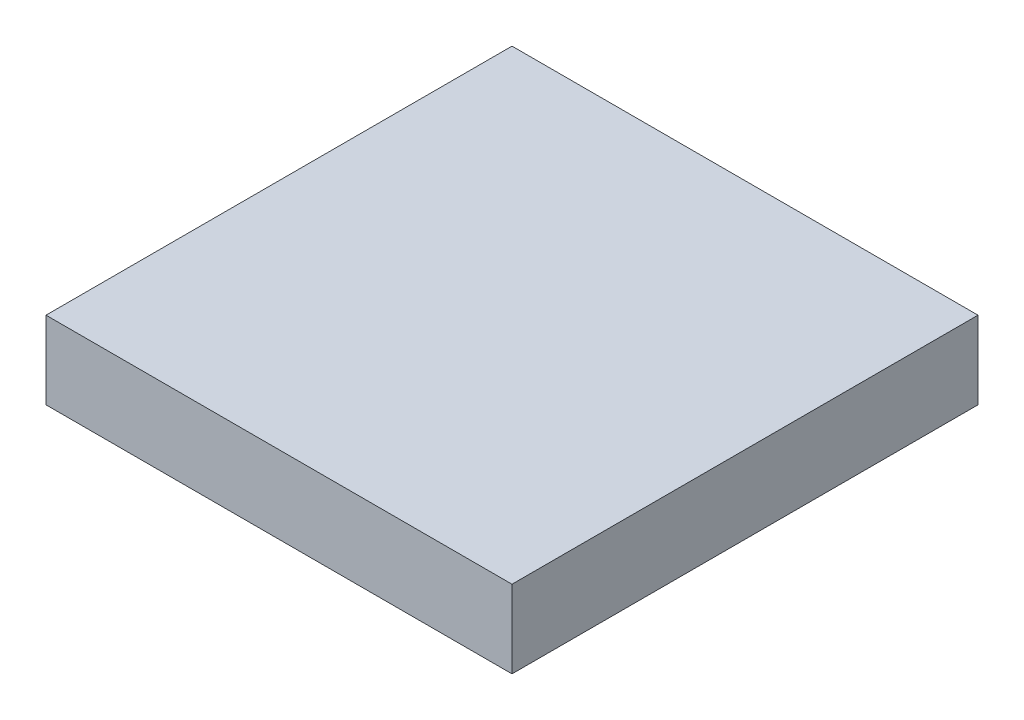
from build123d import *

# Parameters (mm, degrees)
SKETCH1_W           = 600
SKETCH1_H           = 600
BOSS_EXTRUDE1_DEPTH = 100


with BuildPart() as part:
    # Sketch1 → Boss-Extrude1 (new body)
    with BuildSketch(Plane(origin=(0, 0, 0), x_dir=(1, 0, 0), z_dir=(0, 1, 0))):
        Rectangle(SKETCH1_W, SKETCH1_H)
    extrude(amount=BOSS_EXTRUDE1_DEPTH)


solid = part.part
